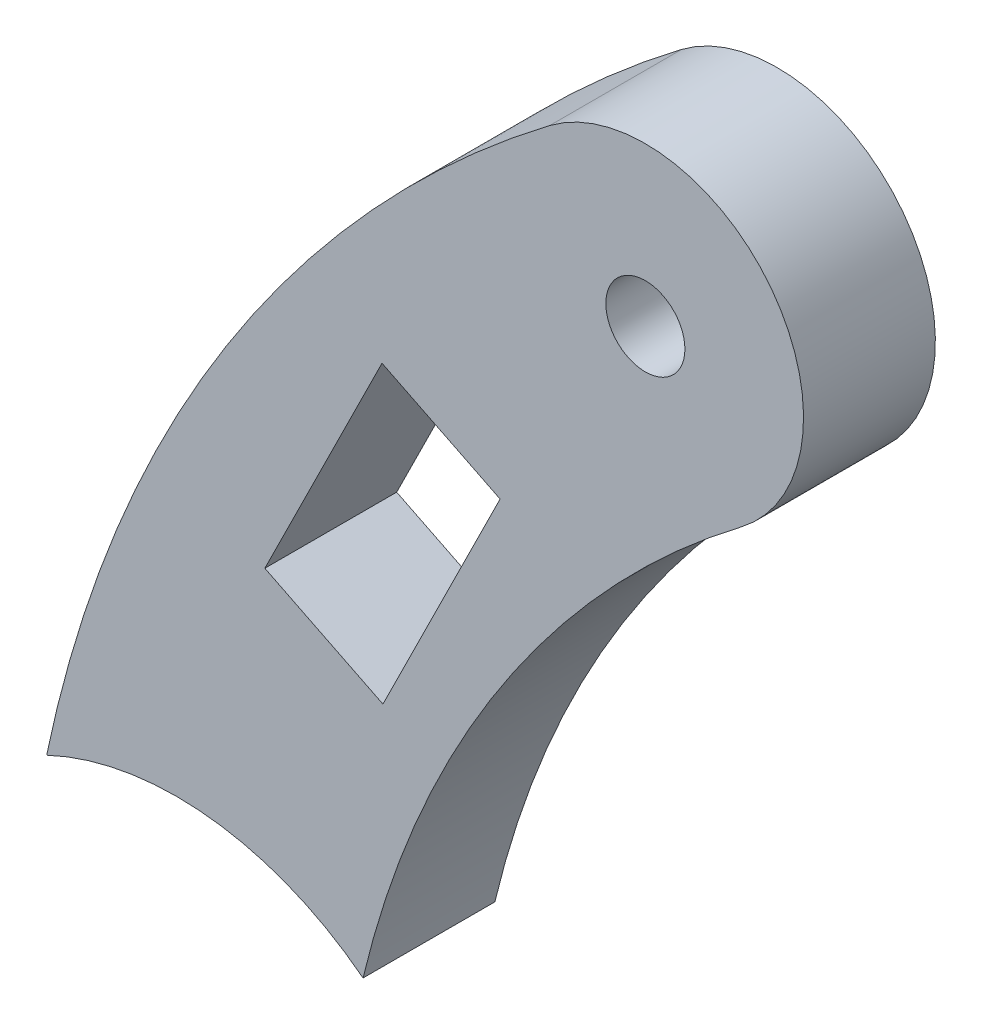
from build123d import *

# Parameters (mm, degrees)
ESQUISSE1_R        = 1.5
BOSS_EXTRU_1_DEPTH = 5


with BuildPart() as part:
    # Esquisse1 → Boss.-Extru.1 (new body)
    with BuildSketch(Plane.XY):
        with BuildLine():
            ThreePointArc((-30.851851852, 40.60989088), (-43.125037525, 27.225560389), (-49.930555556, 10.389399497))
            ThreePointArc((-49.930555556, 10.389399497), (-43.743567635, 11.431158196), (-37.930555556, 9.070444049))
            ThreePointArc((-37.930555556, 9.070444049), (-32.666503706, 21.304918109), (-23.592592593, 31.054622438))
            ThreePointArc((-23.592592593, 31.054622438), (-22.444588001, 39.461886289), (-30.851851852, 40.60989088))
        make_face()
        with Locations((-27.222222222, 35.832256659)):
            Circle(ESQUISSE1_R, mode=Mode.SUBTRACT)
        Polygon((-41.654998366, 20.666666667), (-37.175966284, 18.444444444), (-32.731521839, 27.402508609), (-37.210553922, 29.624730831), align=None, mode=Mode.SUBTRACT)
    extrude(amount=BOSS_EXTRU_1_DEPTH)


solid = part.part
